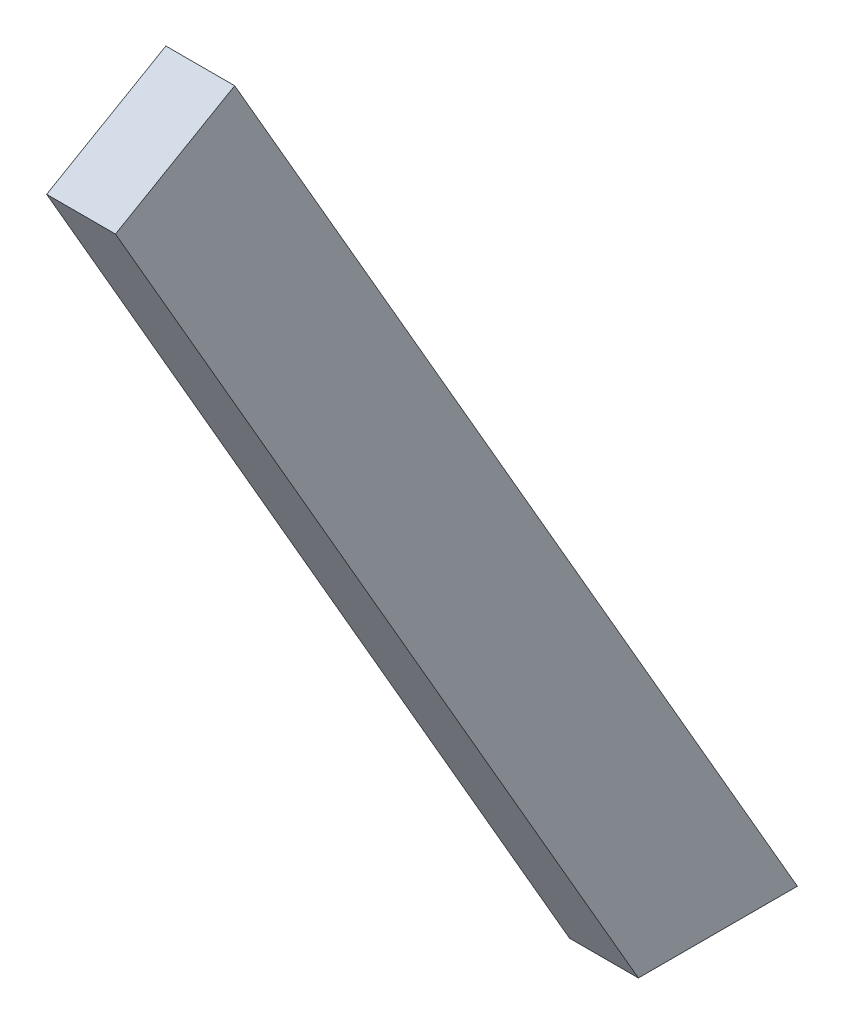
from build123d import *

# Parameters (mm, degrees)
BOSS_EXTRUDE1_DEPTH = 25.4


with BuildPart() as part:
    # Sketch2 → Boss-Extrude1 (new body)
    with BuildSketch(Plane(origin=(0, 0, 0), x_dir=(0, 0, -1), z_dir=(1, 0, 0))):
        Polygon((0, 0), (-192.984980678, 334.259791632), (-148.990890165, 359.659791632), (58.65878735, 0), align=None)
    extrude(amount=BOSS_EXTRUDE1_DEPTH)


solid = part.part
